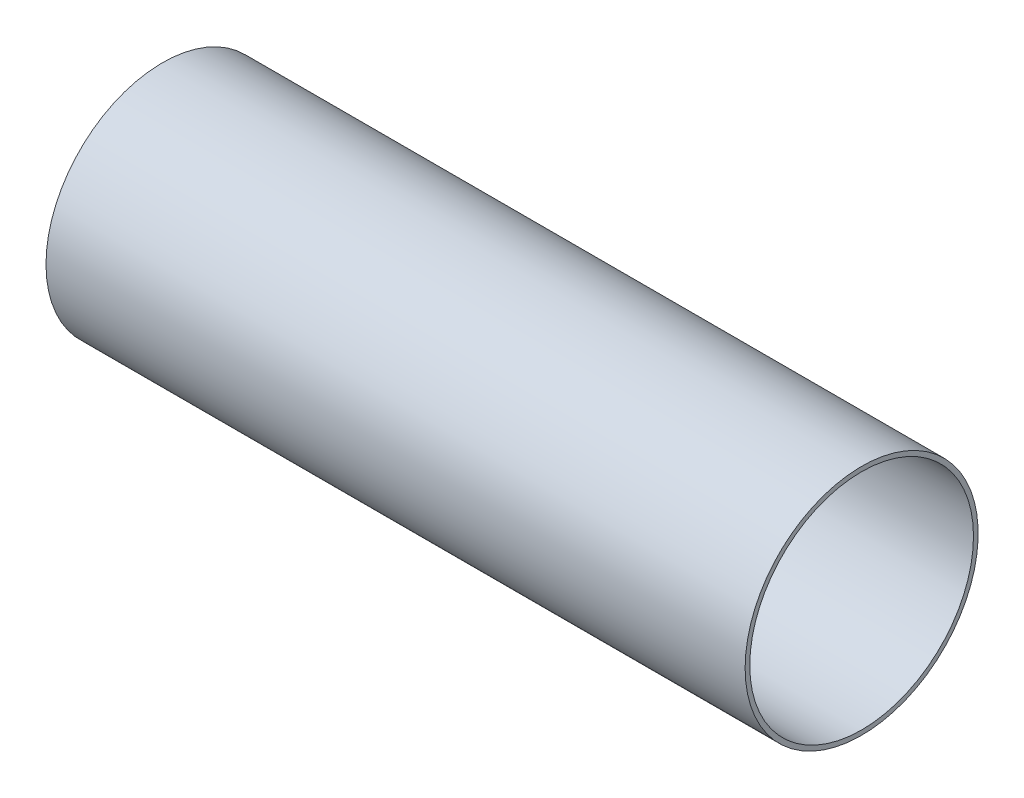
from build123d import *

# Parameters (mm, degrees)
BEAMSKETCH_W = 300
BEAMSKETCH_H = 2


with BuildPart() as part:
    # BeamSketch → Beam (revolve)
    with BuildSketch(Plane.XY, mode=Mode.PRIVATE) as beam_sk:
        with Locations((0, 49)):
            Rectangle(BEAMSKETCH_W, BEAMSKETCH_H)
    revolve(beam_sk.sketch.rotate(Axis((-21.890481714, 0, 0), (1, 0, 0)), 90), axis=Axis((-21.890481714, 0, 0), (1, 0, 0)))


solid = part.part
